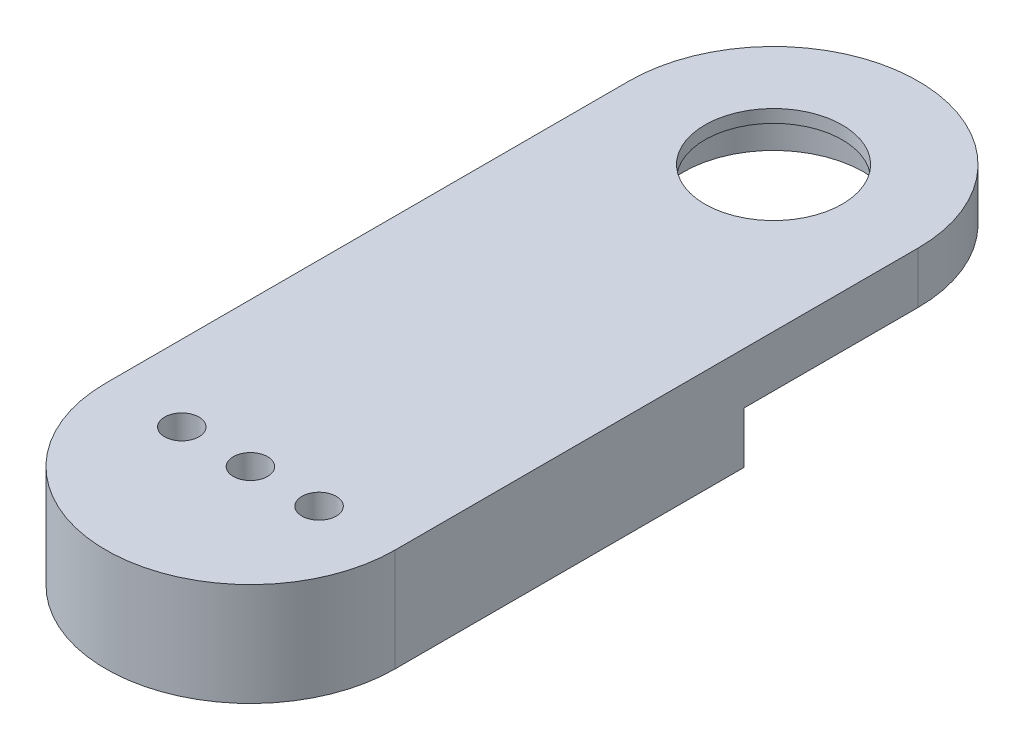
from build123d import *

# Parameters (mm, degrees)
SKETCH1_R           = 10.499999955
SKETCH1_R_2         = 2
BOSS_EXTRUDE1_DEPTH = 12
SKETCH2_R           = 10.499999955
CUT_EXTRUDE1_DEPTH  = 6
BOSS_EXTRUDE2_START = -1.5
SKETCH3_R           = 10.499999955
SKETCH3_R_2         = 8
BOSS_EXTRUDE2_DEPTH = 1.5


with BuildPart() as part:
    # Sketch1 → Boss-Extrude1 (new body)
    with BuildSketch(Plane(origin=(0, 0, 0), x_dir=(1, 0, 0), z_dir=(0, 1, 0))):
        with BuildLine():
            Line((-16.85, 0), (-16.85, 60.96))
            ThreePointArc((-16.85, 60.96), (0, 77.81), (16.85, 60.96))
            Line((16.85, 60.96), (16.85, 0))
            ThreePointArc((16.85, 0), (0, -16.85), (-16.85, 0))
        make_face()
        with Locations(Location((0, 60.96, 0), (0, 0, 270))):
            Circle(SKETCH1_R, mode=Mode.SUBTRACT)
        with Locations(Location((-8, 0, 0), (0, 0, 270))):
            Circle(SKETCH1_R_2, mode=Mode.SUBTRACT)
        with Locations(Location((8, 0, 0), (0, 0, 270))):
            Circle(SKETCH1_R_2, mode=Mode.SUBTRACT)
        with Locations(Location((0, 0, 0), (0, 0, 270))):
            Circle(SKETCH1_R_2, mode=Mode.SUBTRACT)
    extrude(amount=BOSS_EXTRUDE1_DEPTH)

    # Sketch2 → Cut-Extrude1 (cut)
    with BuildSketch(Plane.XZ):
        with BuildLine():
            Line((-16.85, -40.64), (-16.85, -60.96))
            ThreePointArc((-16.85, -60.96), (0, -77.81), (16.85, -60.96))
            Line((16.85, -60.96), (16.85, -40.64))
            Line((16.85, -40.64), (-16.85, -40.64))
        make_face()
        with Locations(Location((0, -60.96, 0), (0, 0, 270))):
            Circle(SKETCH2_R, mode=Mode.SUBTRACT)
    extrude(amount=-CUT_EXTRUDE1_DEPTH, mode=Mode.SUBTRACT)

    # Sketch3 → Boss-Extrude2 (add)
    with BuildSketch(Plane(origin=(0, 12, 0), x_dir=(1, 0, 0), z_dir=(0, 1, 0)).offset(BOSS_EXTRUDE2_START)):
        with Locations(Location((0, 60.96, 0), (0, 0, 90))):
            Circle(SKETCH3_R)
        with Locations(Location((0, 60.96, 0), (0, 0, 270))):
            Circle(SKETCH3_R_2, mode=Mode.SUBTRACT)
    extrude(amount=BOSS_EXTRUDE2_DEPTH)


solid = part.part
